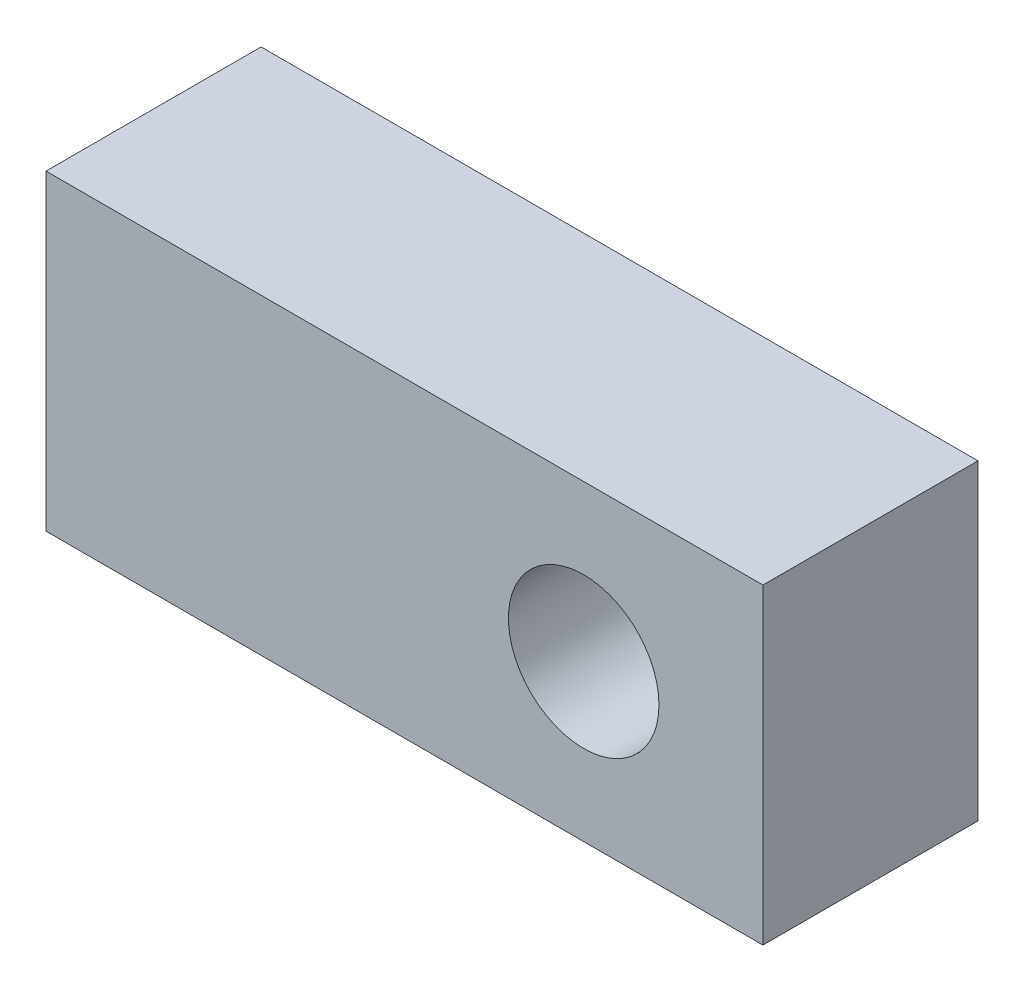
from build123d import *

# Parameters (mm, degrees)
SKETCH_1_W      = 20
SKETCH_1_H      = 8.7
SKETCH_1_R      = 2.1
EXTRUDE_1_DEPTH = 3


with BuildPart() as part:
    # 草图1 → 凸台-拉伸1 (new, symmetric)
    with BuildSketch(Plane.XY):
        Rectangle(SKETCH_1_W, SKETCH_1_H)
        with Locations((5, 0)):
            Circle(SKETCH_1_R, mode=Mode.SUBTRACT)
    extrude(amount=EXTRUDE_1_DEPTH, both=True)


solid = part.part
